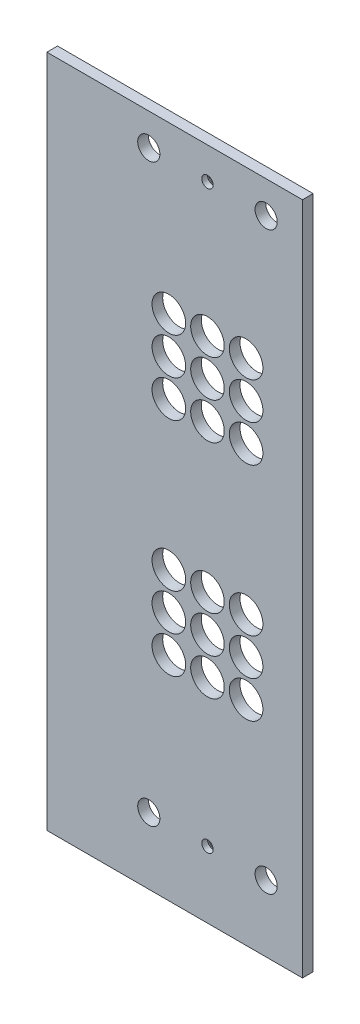
from build123d import *

# Parameters (mm, degrees)
SKETCH1_W                                       = 56.55
SKETCH1_H                                       = 197.425
BOSS_EXTRUDE1_DEPTH                             = 3.175
SKETCH2_R                                       = 5
CUT_EXTRUDE1_DEPTH                              = 103.731270343
SKETCH5_W                                       = 3.175
SKETCH5_H                                       = 197.425
BOSS_EXTRUDE2_DEPTH                             = 19.525
SKETCH14_W                                      = 76.075
SKETCH14_H                                      = 3.175
BOSS_EXTRUDE3_DEPTH                             = 3.175
M6_CLEARANCE_HOLE1_D                            = 6.6
CSK_FOR_M3_FLAT_HEAD_MACHINE_SCREW5_D           = 3.4
CSK_FOR_M3_FLAT_HEAD_MACHINE_SCREW5_CSINK_D     = 6.3
CSK_FOR_M3_FLAT_HEAD_MACHINE_SCREW5_CSINK_ANGLE = 90


with BuildPart() as part:
    # Sketch1 → Boss-Extrude1 (new body)
    with BuildSketch(Plane.XY):
        Rectangle(SKETCH1_W, SKETCH1_H)
    extrude(amount=BOSS_EXTRUDE1_DEPTH)

    # Sketch2 → Cut-Extrude1 (cut, through all)
    with BuildSketch(Plane(origin=(0, 0, 0), x_dir=(-1, 0, 0), z_dir=(0, 0, -1))):
        with Locations((-11.5, 30.630837161)):
            Circle(SKETCH2_R)
        with Locations((-11.5, 52.630837161)):
            Circle(SKETCH2_R)
        with Locations((-11.5, 41.630837161)):
            Circle(SKETCH2_R)
        with Locations((0, 52.630837161)):
            Circle(SKETCH2_R)
        with Locations((0, 41.630837161)):
            Circle(SKETCH2_R)
        with Locations((0, 30.630837161)):
            Circle(SKETCH2_R)
        with Locations((11.5, 30.630837161)):
            Circle(SKETCH2_R)
        with Locations((11.5, 41.630837161)):
            Circle(SKETCH2_R)
        with Locations((11.5, 52.630837161)):
            Circle(SKETCH2_R)
        with Locations((-11.5, -35.369162839)):
            Circle(SKETCH2_R)
        with Locations((-11.5, -13.369162839)):
            Circle(SKETCH2_R)
        with Locations((-11.5, -24.369162839)):
            Circle(SKETCH2_R)
        with Locations((0, -13.369162839)):
            Circle(SKETCH2_R)
        with Locations((0, -24.369162839)):
            Circle(SKETCH2_R)
        with Locations((0, -35.369162839)):
            Circle(SKETCH2_R)
        with Locations((11.5, -35.369162839)):
            Circle(SKETCH2_R)
        with Locations((11.5, -13.369162839)):
            Circle(SKETCH2_R)
        with Locations((11.5, -24.369162839)):
            Circle(SKETCH2_R)
    extrude(amount=-CUT_EXTRUDE1_DEPTH, mode=Mode.SUBTRACT)

    # Sketch5 → Boss-Extrude2 (add)
    with BuildSketch(Plane.ZY.offset(28.275)):
        with Locations((1.5875, 0)):
            Rectangle(SKETCH5_W, SKETCH5_H)
    extrude(amount=BOSS_EXTRUDE2_DEPTH)

    # Sketch14 → Boss-Extrude3 (add)
    with BuildSketch(Plane(origin=(0, 98.7125, 0), x_dir=(1, 0, 0), z_dir=(0, 1, 0))):
        with Locations((-9.7625, -1.5875)):
            Rectangle(SKETCH14_W, SKETCH14_H)
    extrude(amount=BOSS_EXTRUDE3_DEPTH)

    # M6 Clearance Hole1 (through all)
    with Locations(Plane.XY.offset(3.175)):
        with Locations((-17.4625, 92.3625001), (17.4625, 92.3625001), (17.4625, -78.8874999), (-17.4625, -78.8874999)):
            Hole(M6_CLEARANCE_HOLE1_D / 2)

    # CSK for M3 Flat Head Machine Screw5 (through all)
    with Locations(Plane(origin=(0, 0, 0), x_dir=(-1, 0, 0), z_dir=(0, 0, -1))):
        with Locations((0, -78.8874999), (0, 92.3625001)):
            CounterSinkHole(CSK_FOR_M3_FLAT_HEAD_MACHINE_SCREW5_D / 2, CSK_FOR_M3_FLAT_HEAD_MACHINE_SCREW5_CSINK_D / 2, counter_sink_angle=CSK_FOR_M3_FLAT_HEAD_MACHINE_SCREW5_CSINK_ANGLE)


solid = part.part
